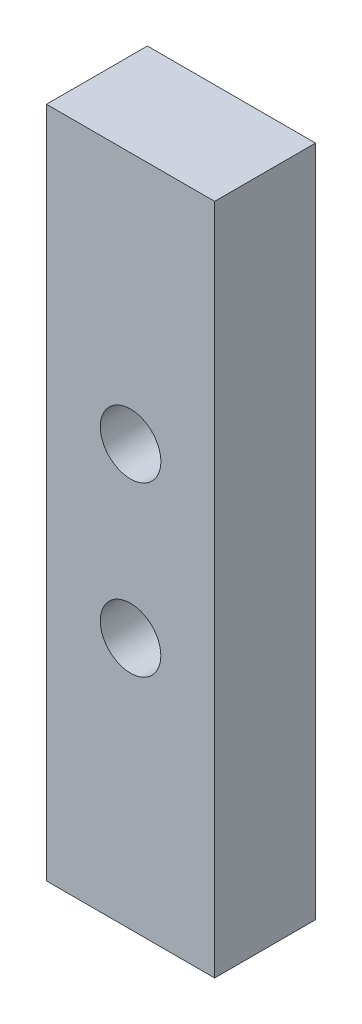
from build123d import *

# Parameters (mm, degrees)
SKETCH1_W           = 20
SKETCH1_H           = 5
SKETCH1_R           = 0.9
BOSS_EXTRUDE1_DEPTH = 3


with BuildPart() as part:
    # Sketch1 → Boss-Extrude1 (new body)
    with BuildSketch(Plane(origin=(0, 0, 0), x_dir=(0, 1, 0), z_dir=(0, 0, 1))):
        Rectangle(SKETCH1_W, SKETCH1_H)
        with Locations(Location((-2.5, 0, 0), (0, 0, 270))):
            Circle(SKETCH1_R, mode=Mode.SUBTRACT)
        with Locations(Location((2.5, 0, 0), (0, 0, 90))):
            Circle(SKETCH1_R, mode=Mode.SUBTRACT)
    extrude(amount=BOSS_EXTRUDE1_DEPTH)


solid = part.part
